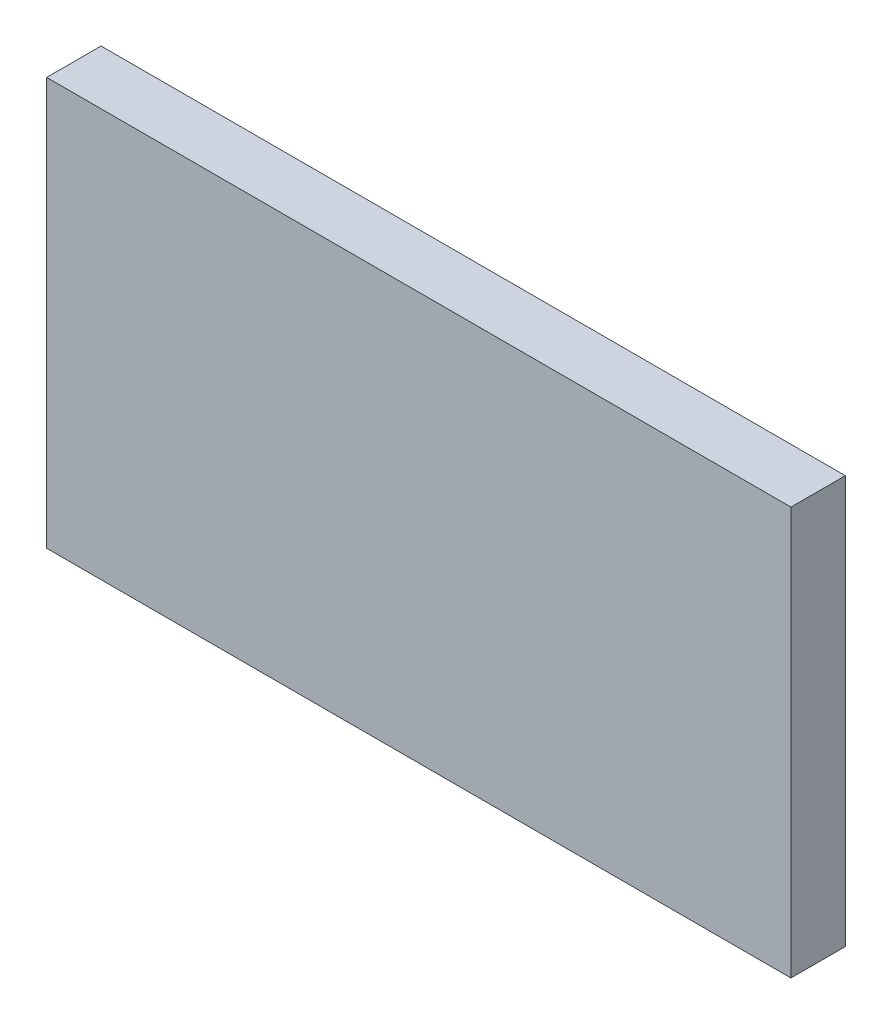
from build123d import *

# Parameters (mm, degrees)
CURVESKETCH_W   = 31.719
CURVESKETCH_H   = 17.381
CURVEBOSS_DEPTH = 1.1585


with BuildPart() as part:
    # CurveSketch → CurveBoss (new, symmetric)
    with BuildSketch(Plane.XY):
        with Locations((-4.193, 6.827)):
            Rectangle(CURVESKETCH_W, CURVESKETCH_H)
    extrude(amount=CURVEBOSS_DEPTH, both=True)


solid = part.part
